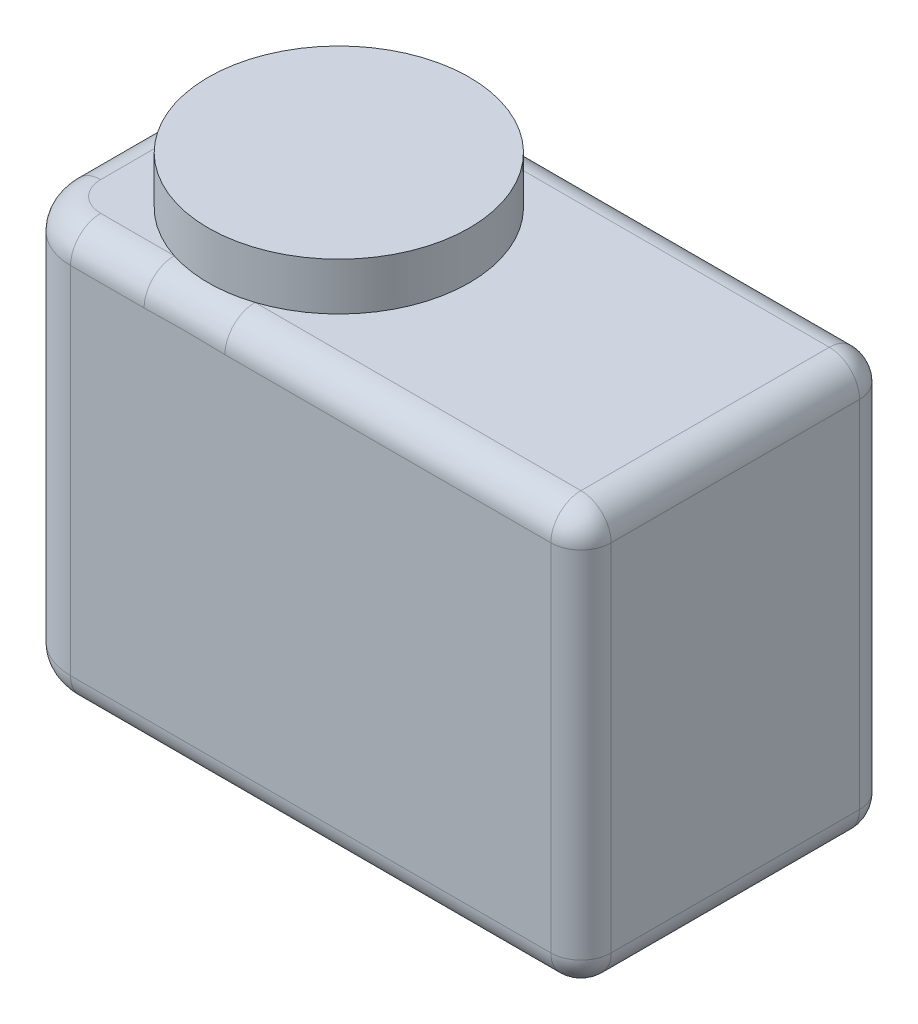
from build123d import *

# Parameters (mm, degrees)
BOSS_EXTRUDE1_DEPTH = 35
SKETCH2_R           = 11
BOSS_EXTRUDE2_DEPTH = 4
FILLET1_R           = 2.54
FILLET2_R           = 2.54


with BuildPart() as part:
    # Sketch1 → Boss-Extrude1 (new body)
    with BuildSketch(Plane(origin=(0, 0, 0), x_dir=(1, 0, 0), z_dir=(0, 1, 0))):
        with BuildLine():
            Line((-19, -13), (24, -13))
            Line((24, -13), (24, 13))
            Line((24, 13), (-19, 13))
            ThreePointArc((-19, 13), (-22.535533906, 11.535533906), (-24, 8))
            Line((-24, 8), (-24, -8))
            ThreePointArc((-24, -8), (-22.535533906, -11.535533906), (-19, -13))
        make_face()
    extrude(amount=BOSS_EXTRUDE1_DEPTH)

    # Sketch2 → Boss-Extrude2 (add)
    with BuildSketch(Plane(origin=(0, 35, 0), x_dir=(1, 0, 0), z_dir=(0, 1, 0))):
        with Locations(Location((-9.4, 0, 0), (0, 0, 90))):
            Circle(SKETCH2_R)
    extrude(amount=BOSS_EXTRUDE2_DEPTH)

    # Fillet1
    fillet1_edges = [part.edges().sort_by_distance(p)[0] for p in [
        (2.5, 35, 13),
        (-22.535533906, 35, 11.535533906),
        (-24, 35, 0),
        (-22.535533906, 35, -11.535533906),
        (-24, 0, 0),
        (-22.535533906, 0, 11.535533906),
        (2.5, 0, 13),
        (2.5, 35, -13),
        (2.5, 0, -13),
        (-22.535533906, 0, -11.535533906),
    ]]
    fillet(fillet1_edges, radius=FILLET1_R)

    # Fillet2
    fillet2_edges = [part.edges().sort_by_distance(p)[0] for p in [
        (24, 17.5, 13),
        (24, 0, 0),
        (24, 17.5, -13),
        (24, 35, 0),
        (24, 34.256051224, 12.256051224),
        (24, 34.256051224, -12.256051224),
        (24, 0.743948776, -12.256051224),
        (24, 0.743948776, 12.256051224),
    ]]
    fillet(fillet2_edges, radius=FILLET2_R)


solid = part.part
